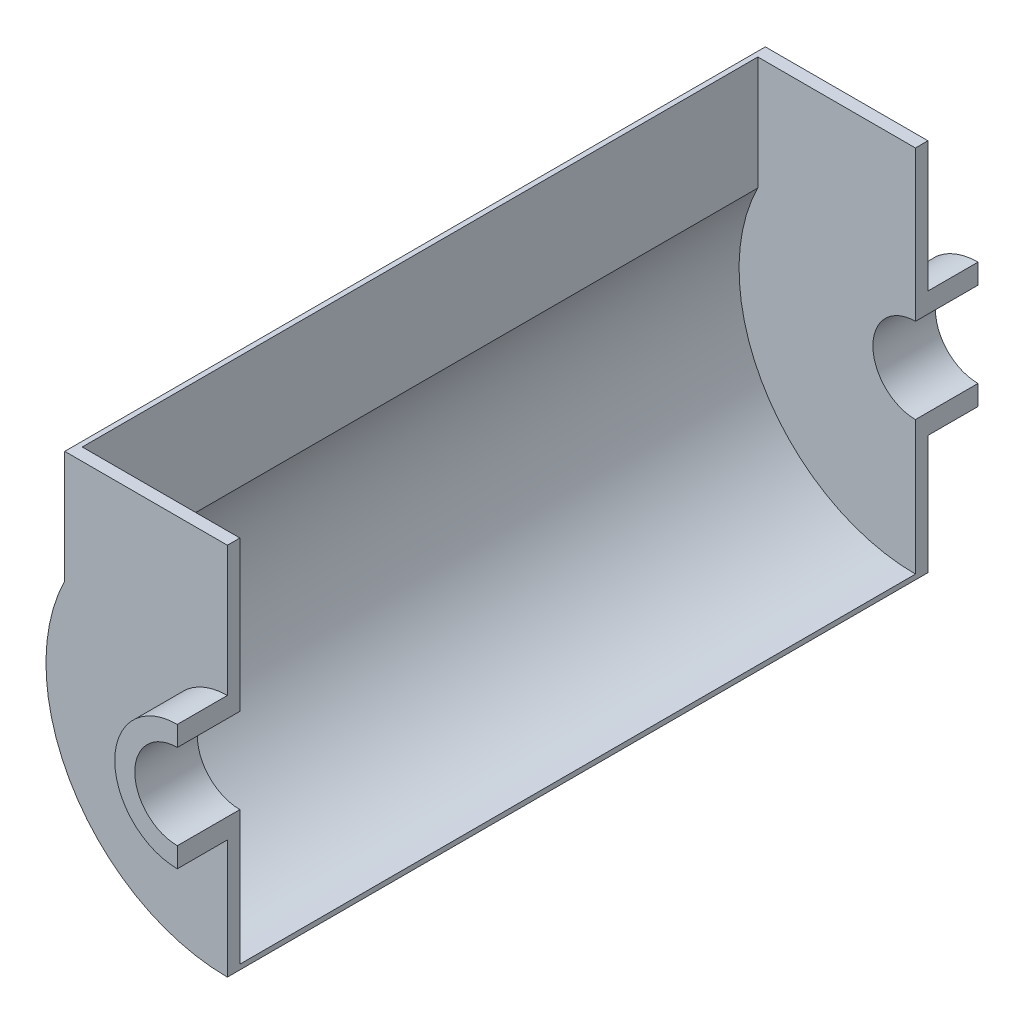
from build123d import *

# Parameters (mm, degrees)
BOSS_EXTRUDE1_DEPTH      = 20
BOSS_EXTRUDE1_DEPTH_BACK = 5
BOSS_EXTRUDE2_START      = -5
BOSS_EXTRUDE2_DEPTH      = 5
BOSS_EXTRUDE4_REACH      = 315.385


with BuildPart() as part:
    # Sketch1 → Boss-Extrude1 (new, two sides: drawn at the far end of the back side and taken through both)
    with BuildSketch(Plane.XY.offset(-BOSS_EXTRUDE1_DEPTH_BACK)):
        with BuildLine():
            Line((0, 25), (0, 17))
            ThreePointArc((0, 17), (-17, 0), (0, -17))
            Line((0, -17), (0, -25))
            ThreePointArc((0, -25), (-25, 0), (0, 25))
        make_face()
    extrude(amount=BOSS_EXTRUDE1_DEPTH + BOSS_EXTRUDE1_DEPTH_BACK)

    # Sketch2 → Boss-Extrude2 (add)
    with BuildSketch(Plane.XY.offset(BOSS_EXTRUDE2_START)):
        with BuildLine():
            Line((0, 25), (0, 77))
            Line((0, 77), (-65, 77))
            Line((-65, 77), (-65, 32.113081447))
            ThreePointArc((-65, 32.113081447), (-61.581037686, -38.262590053), (0, -72.5))
            Line((0, -72.5), (0, -25))
            ThreePointArc((0, -25), (-25, 0), (0, 25))
        make_face()
    extrude(amount=BOSS_EXTRUDE2_DEPTH)


with BuildPart() as body_2:
    # Mirror1: mirrored copy
    add(part.part.mirror(Plane.XY.offset(-140)))

    # Sketch3 → Boss-Extrude4 (add, up to next)
    with BuildSketch(Plane(origin=(0, 0, -5), x_dir=(-1, 0, 0), z_dir=(0, 0, -1)), mode=Mode.PRIVATE) as boss_extrude4_sk1:
        with BuildLine():
            Line((63, 31.642534665), (63, 77))
            Line((63, 77), (65, 77))
            Line((65, 77), (65, 32.113081447))
            ThreePointArc((65, 32.113081447), (61.581037686, -38.262590053), (0, -72.5))
            Line((0, -72.5), (0, -70.5))
            ThreePointArc((0, -70.5), (60.004369399, -37.009804823), (63, 31.642534665))
        make_face()
    boss_extrude4_tool1 = extrude(boss_extrude4_sk1.sketch, amount=BOSS_EXTRUDE4_REACH, mode=Mode.PRIVATE) - body_2.part

    add(part.part)  # Boss-Extrude4 merges part
    add(boss_extrude4_tool1.solids().sort_by_distance((-64.66152, 54.321267, -5))[0])


solid = body_2.part
